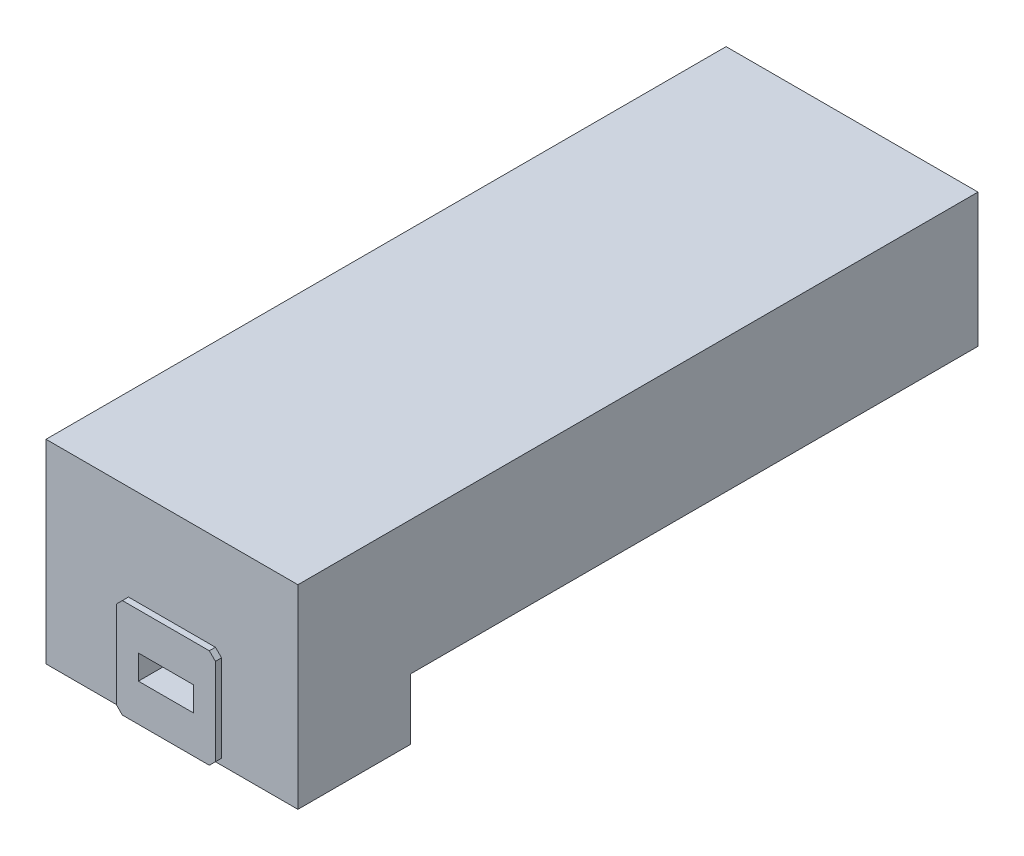
from build123d import *

# Parameters (mm, degrees)
SKETCH1_W           = 111.5
SKETCH1_H           = 31.9
BOSS_EXTRUDE1_DEPTH = 41.3
SKETCH2_W           = 93
SKETCH2_H           = 10
CUT_EXTRUDE1_DEPTH  = 124.10787952
SKETCH3_W           = 16.26
SKETCH3_H           = 16.26
BOSS_EXTRUDE2_DEPTH = 1
SKETCH4_W           = 9
SKETCH4_H           = 4
CUT_EXTRUDE2_DEPTH  = 15
CHAMFER1_SIZE       = 1


with BuildPart() as part:
    # Sketch1 → Boss-Extrude1 (new body)
    with BuildSketch(Plane(origin=(0, 0, 0), x_dir=(0, 0, -1), z_dir=(1, 0, 0))):
        with Locations((55.75, 15.95)):
            Rectangle(SKETCH1_W, SKETCH1_H)
    extrude(amount=-BOSS_EXTRUDE1_DEPTH)

    # Sketch2 → Cut-Extrude1 (cut, through all)
    with BuildSketch(Plane(origin=(0, 0, 0), x_dir=(0, 0, -1), z_dir=(1, 0, 0))):
        with Locations((65, 5)):
            Rectangle(SKETCH2_W, SKETCH2_H)
    extrude(amount=-CUT_EXTRUDE1_DEPTH, mode=Mode.SUBTRACT)

    # Sketch3 → Boss-Extrude2 (add)
    with BuildSketch(Plane.XY):
        with Locations((-20.65, 8.13)):
            Rectangle(SKETCH3_W, SKETCH3_H)
    extrude(amount=BOSS_EXTRUDE2_DEPTH)

    # Sketch4 → Cut-Extrude2 (cut)
    with BuildSketch(Plane.XY.offset(1)):
        with Locations((-20.65, 8.13)):
            Rectangle(SKETCH4_W, SKETCH4_H)
    extrude(amount=-CUT_EXTRUDE2_DEPTH, mode=Mode.SUBTRACT)

    # Chamfer1
    chamfer1_edges = [part.edges().sort_by_distance(p)[0] for p in [
        (-12.52, 0, 0.5),
        (-12.52, 16.26, 0.5),
        (-28.78, 16.26, 0.5),
        (-28.78, 0, 0.5),
    ]]
    chamfer(chamfer1_edges, length=CHAMFER1_SIZE)


solid = part.part
